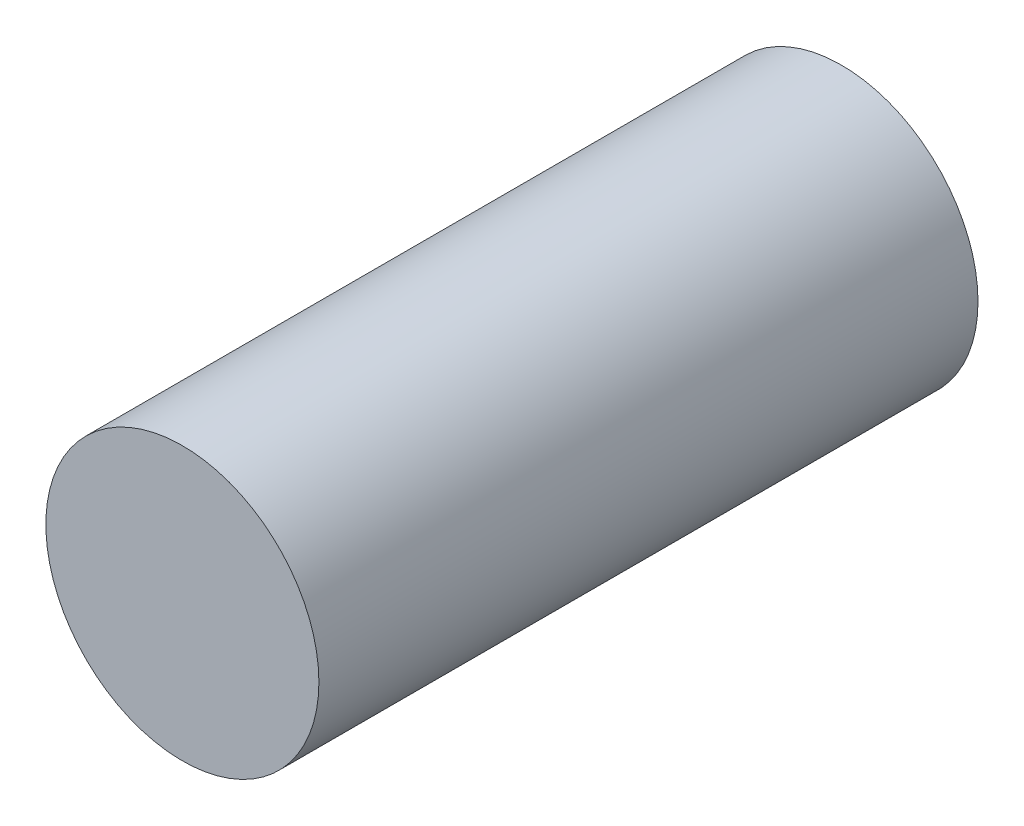
from build123d import *

# Parameters (mm, degrees)
SKETCH1_R           = 1.45
BOSS_EXTRUDE1_DEPTH = 7


with BuildPart() as part:
    # Sketch1 → Boss-Extrude1 (new body)
    with BuildSketch(Plane.XY):
        Circle(SKETCH1_R)
    extrude(amount=BOSS_EXTRUDE1_DEPTH)


solid = part.part
